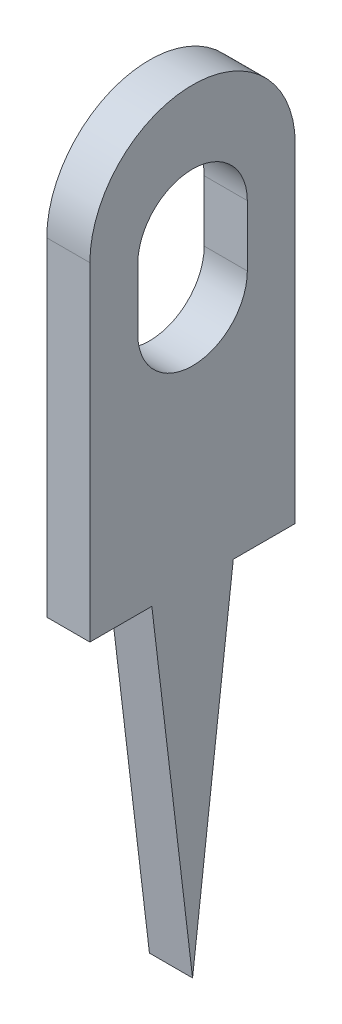
from build123d import *

# Parameters (mm, degrees)
BOSS_EXTRUDE1_DEPTH      = 0.315
BOSS_EXTRUDE1_DEPTH_BACK = 0.315


with BuildPart() as part:
    # Sketch2 → Boss-Extrude1 (new, two sides: drawn at the far end of the back side and taken through both)
    with BuildSketch(Plane(origin=(0, 0, 0), x_dir=(0, 0, -1), z_dir=(1, 0, 0)).offset(-BOSS_EXTRUDE1_DEPTH_BACK)):
        with BuildLine():
            Line((1.5, 0), (0.595, 0))
            Line((0.595, 0), (0, -5))
            Line((0, -5), (-0.595, 0))
            Line((-0.595, 0), (-1.5, 0))
            Line((-1.5, 0), (-1.5, 4.8))
            ThreePointArc((-1.5, 4.8), (0, 6.3), (1.5, 4.8))
            Line((1.5, 4.8), (1.5, 0))
        make_face()
        with BuildLine():
            Line((-0.8, 3.545), (-0.8, 4.435))
            ThreePointArc((-0.8, 4.435), (0, 5.235), (0.8, 4.435))
            Line((0.8, 4.435), (0.8, 3.545))
            ThreePointArc((0.8, 3.545), (0, 2.745), (-0.8, 3.545))
        make_face(mode=Mode.SUBTRACT)
    extrude(amount=BOSS_EXTRUDE1_DEPTH + BOSS_EXTRUDE1_DEPTH_BACK)


solid = part.part
